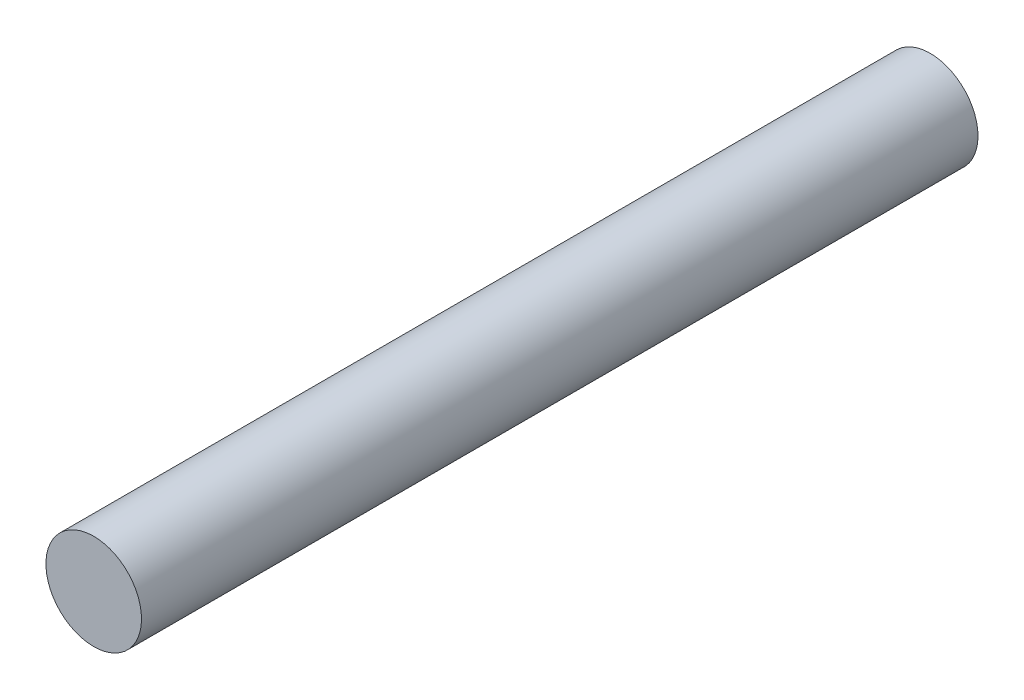
from build123d import *

# Parameters (mm, degrees)
ESQUISSE1_R        = 4
BOSS_EXTRU_1_DEPTH = 70


with BuildPart() as part:
    # Esquisse1 → Boss.-Extru.1 (new body)
    with BuildSketch(Plane.XY):
        Circle(ESQUISSE1_R)
    extrude(amount=BOSS_EXTRU_1_DEPTH)


solid = part.part
